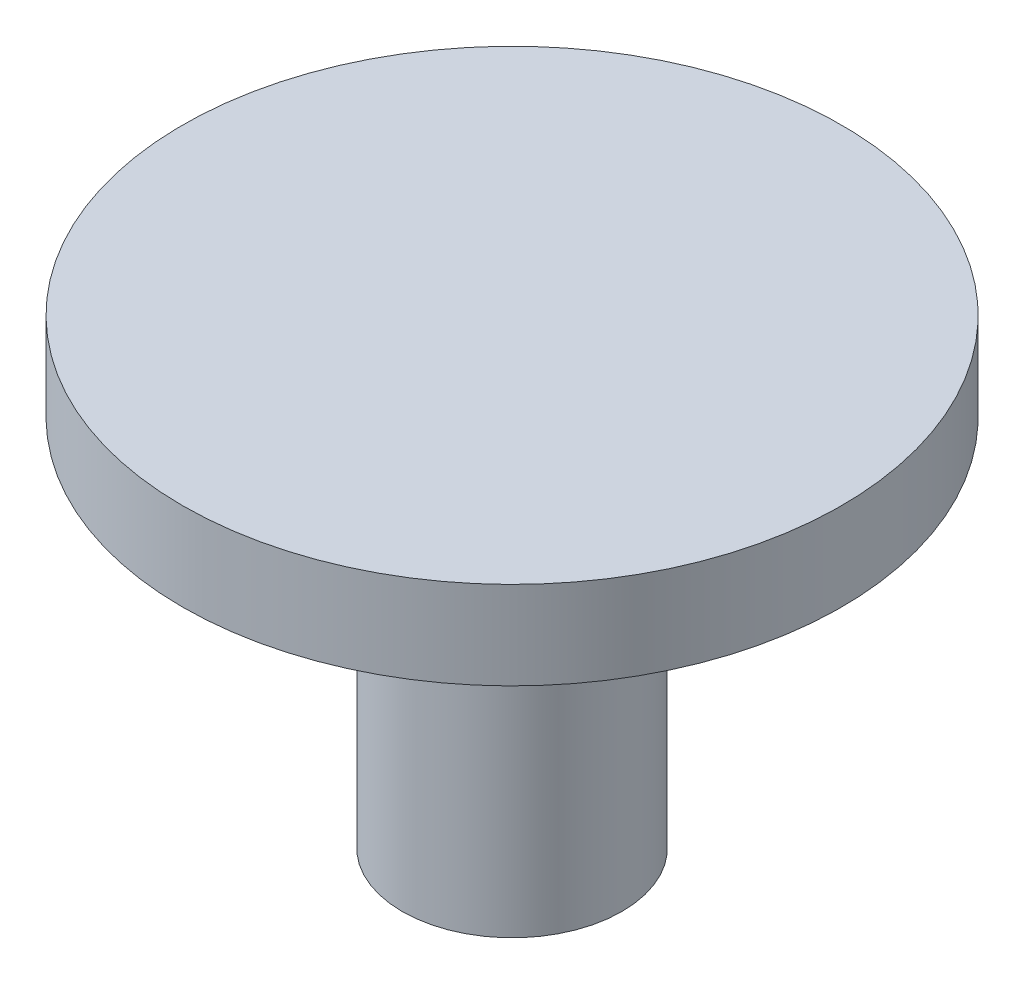
from build123d import *

# Parameters (mm, degrees)
SKETCH_1_R      = 5
EXTRUDE_1_DEPTH = 9
SKETCH_5_R      = 5
EXTRUDE_5_DEPTH = 8
SKETCH_6_R      = 15
EXTRUDE_6_DEPTH = 4
CHAMFER_3_SIZE  = 1


with BuildPart() as part:
    # 草图1 → 凸台-拉伸1 (new body)
    with BuildSketch(Plane(origin=(0, 0, 0), x_dir=(1, 0, 0), z_dir=(0, 1, 0))):
        with Locations(Location((0, 0, 0), (0, 0, 270))):
            Circle(SKETCH_1_R)
        with BuildLine():
            Line((2.577287197, 1.63097845), (-2.485447743, 1.767780959))
            ThreePointArc((-2.485447743, 1.767780959), (-0.082385393, -3.048887116), (2.577287197, 1.63097845))
        make_face(mode=Mode.SUBTRACT)
    extrude(amount=EXTRUDE_1_DEPTH)

    # 草图5 → 凸台-拉伸5 (add)
    with BuildSketch(Plane(origin=(0, 9, 0), x_dir=(1, 0, 0), z_dir=(0, 1, 0))):
        with Locations(Location((0, 0, 0), (0, 0, 270))):
            Circle(SKETCH_5_R)
    extrude(amount=EXTRUDE_5_DEPTH)

    # 草图6 → 凸台-拉伸6 (add)
    with BuildSketch(Plane(origin=(0, 17, 0), x_dir=(1, 0, 0), z_dir=(0, 1, 0))):
        with Locations(Location((0, 0, 0), (0, 0, 270))):
            Circle(SKETCH_6_R)
    extrude(amount=EXTRUDE_6_DEPTH)

    # 倒角3
    chamfer_3_edges = [part.edges().sort_by_distance(p)[0] for p in [
        (0, 17, -5),
    ]]
    chamfer(chamfer_3_edges, length=CHAMFER_3_SIZE)


solid = part.part
